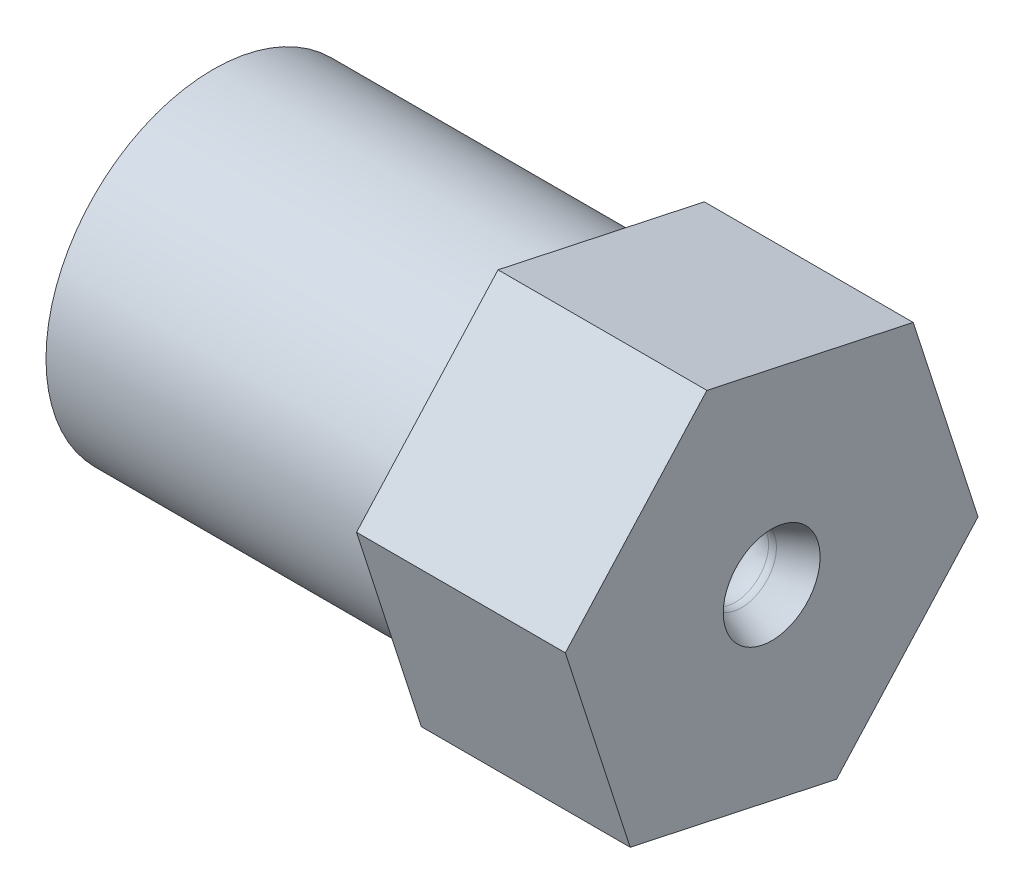
from build123d import *

# Parameters (mm, degrees)
SKETCH4_R           = 10.16
BOSS_EXTRUDE1_DEPTH = 12.7
FILLET1_R           = 0.635


with BuildPart() as part:
    # Sketch1 → Revolve1 (revolve)
    with BuildSketch(Plane.XY, mode=Mode.PRIVATE) as revolve1_sk:
        with BuildLine():
            Line((-2.155261469, 2.924738531), (-2.745586968, 3.51506403))
            ThreePointArc((-2.745586968, 3.51506403), (-3.775631101, 4.203317516), (-4.990650999, 4.445))
            Line((-4.990650999, 4.445), (-13.462, 4.445))
            Line((-13.462, 4.445), (-13.462, 4.699))
            ThreePointArc((-13.462, 4.699), (-13.499197439, 4.788802561), (-13.589, 4.826))
            Line((-13.589, 4.826), (-19.304, 4.826))
            ThreePointArc((-19.304, 4.826), (-19.753012806, 5.011987194), (-19.939, 5.461))
            Line((-19.939, 5.461), (-19.939, 6.8199))
            ThreePointArc((-19.939, 6.8199), (-19.976197439, 6.909702561), (-20.066, 6.9469))
            Line((-20.066, 6.9469), (-24.892, 6.9469))
            Line((-24.892, 6.9469), (-24.892, 7.8994))
            ThreePointArc((-24.892, 7.8994), (-24.929197439, 7.989202561), (-25.019, 8.0264))
            Line((-25.019, 8.0264), (-31.115, 8.0264))
            ThreePointArc((-31.115, 8.0264), (-31.564012806, 8.212387194), (-31.75, 8.6614))
            Line((-31.75, 8.6614), (-31.75, 10.16))
            Line((-31.75, 10.16), (-10.480570528, 10.16))
            Line((-10.480570528, 10.16), (2.219429472, 10.16))
            Line((2.219429472, 10.16), (2.219429472, 2.944647755))
            add(Edge.make_bspline(
                [(2.219429472, 2.944647755), (1.267410542, 2.598141202), (0.381586486, 2.127140197)],
                knots=[0, 0, 0, 1, 1, 1], degree=2))
            ThreePointArc((0.381586486, 2.127140197), (0.196634117, 2.056143634), (0, 2.032))
            ThreePointArc((0, 2.032), (-1.166419102, 2.264015185), (-2.155261469, 2.924738531))
        make_face()
    revolve(revolve1_sk.sketch.rotate(Axis((0, 0, 0), (1, 0, 0)), 90), axis=Axis((0, 0, 0), (1, 0, 0)))

    # Sketch4 → Boss-Extrude1 (add)
    with BuildSketch(Plane(origin=(2.219429472, 0, 0), x_dir=(0, 0, -1), z_dir=(1, 0, 0))):
        Polygon((3.940411868, -12.211607701), (12.545768424, -2.693307071), (8.605356556, 9.51830063), (-3.940411868, 12.211607701), (-12.545768424, 2.693307071), (-8.605356556, -9.51830063), align=None)
        with Locations(Location((0, 0, 0), (0, 0, 180))):
            Circle(SKETCH4_R, mode=Mode.SUBTRACT)
    extrude(amount=-BOSS_EXTRUDE1_DEPTH)

    # Fillet1
    fillet1_edges = [part.edges().sort_by_distance(p)[0] for p in [
        (-10.480570528, 0, -10.16),
    ]]
    fillet(fillet1_edges, radius=FILLET1_R)


solid = part.part
